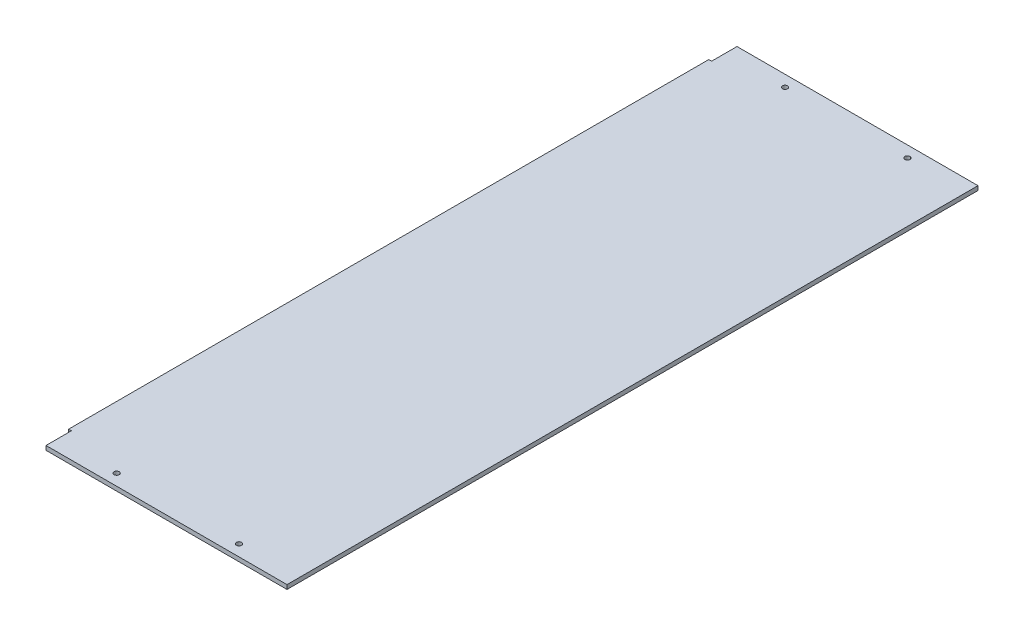
from build123d import *

# Parameters (mm, degrees)
SKETCH1_R           = 2.75
BOSS_EXTRUDE2_DEPTH = 4.5


with BuildPart() as part:
    # Sketch1 → Boss-Extrude2 (new body)
    with BuildSketch(Plane(origin=(0, 0, 0), x_dir=(1, 0, 0), z_dir=(0, 1, 0))):
        Polygon((-128, 343), (128, 343), (128, -391), (-128, -391), (-128, -364), (-131, -364), (-131, 316), (-128, 316), align=None)
        with Locations(Location((-65, 331, 0), (0, 0, 270))):
            Circle(SKETCH1_R, mode=Mode.SUBTRACT)
        with Locations(Location((65, 331, 0), (0, 0, 90))):
            Circle(SKETCH1_R, mode=Mode.SUBTRACT)
        with Locations(Location((65, -379, 0), (0, 0, 270))):
            Circle(SKETCH1_R, mode=Mode.SUBTRACT)
        with Locations(Location((-65, -379, 0), (0, 0, 90))):
            Circle(SKETCH1_R, mode=Mode.SUBTRACT)
    extrude(amount=BOSS_EXTRUDE2_DEPTH)


solid = part.part
